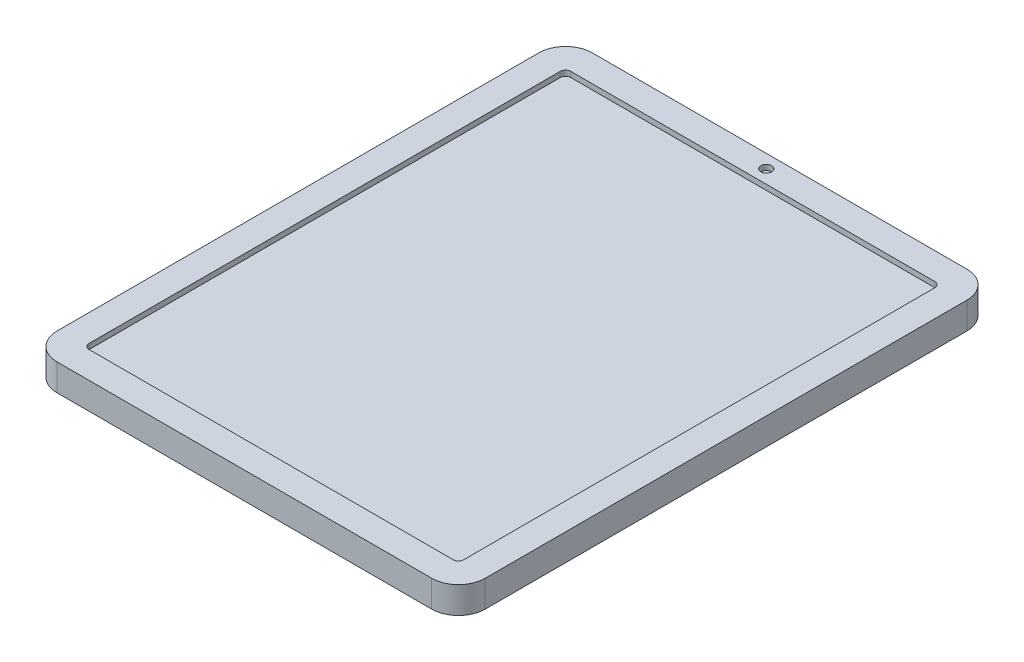
from build123d import *

# Parameters (mm, degrees)
SKETCH_1_W          = 160
SKETCH_1_H          = 200
EXTRUDE_1_DEPTH     = 10
SKETCH_2_R          = 2
SKETCH_2_W          = 140
SKETCH_2_H          = 180
CUT_EXTRUDE_1_DEPTH = 2
FILLET_1_R          = 10
FILLET_2_R          = 2


with BuildPart() as part:
    # 草图1 → 凸台-拉伸1 (new body)
    with BuildSketch(Plane(origin=(0, 0, 0), x_dir=(1, 0, 0), z_dir=(0, 1, 0))):
        Rectangle(SKETCH_1_W, SKETCH_1_H)
    extrude(amount=EXTRUDE_1_DEPTH)

    # 草图2 → 切除-拉伸1 (cut)
    with BuildSketch(Plane(origin=(0, 10, 0), x_dir=(1, 0, 0), z_dir=(0, 1, 0))):
        with Locations(Location((0, 95, 0), (0, 0, 270))):
            Circle(SKETCH_2_R)
        Rectangle(SKETCH_2_W, SKETCH_2_H)
    extrude(amount=-CUT_EXTRUDE_1_DEPTH, mode=Mode.SUBTRACT)

    # 圆角1
    fillet_1_edges = [part.edges().sort_by_distance(p)[0] for p in [
        (-80, 5, -100),
        (80, 5, -100),
        (80, 5, 100),
        (-80, 5, 100),
    ]]
    fillet(fillet_1_edges, radius=FILLET_1_R)

    # 圆角2
    fillet_2_edges = [part.edges().sort_by_distance(p)[0] for p in [
        (-70, 9, 90),
        (-70, 9, -90),
        (70, 9, -90),
        (70, 9, 90),
    ]]
    fillet(fillet_2_edges, radius=FILLET_2_R)


solid = part.part
